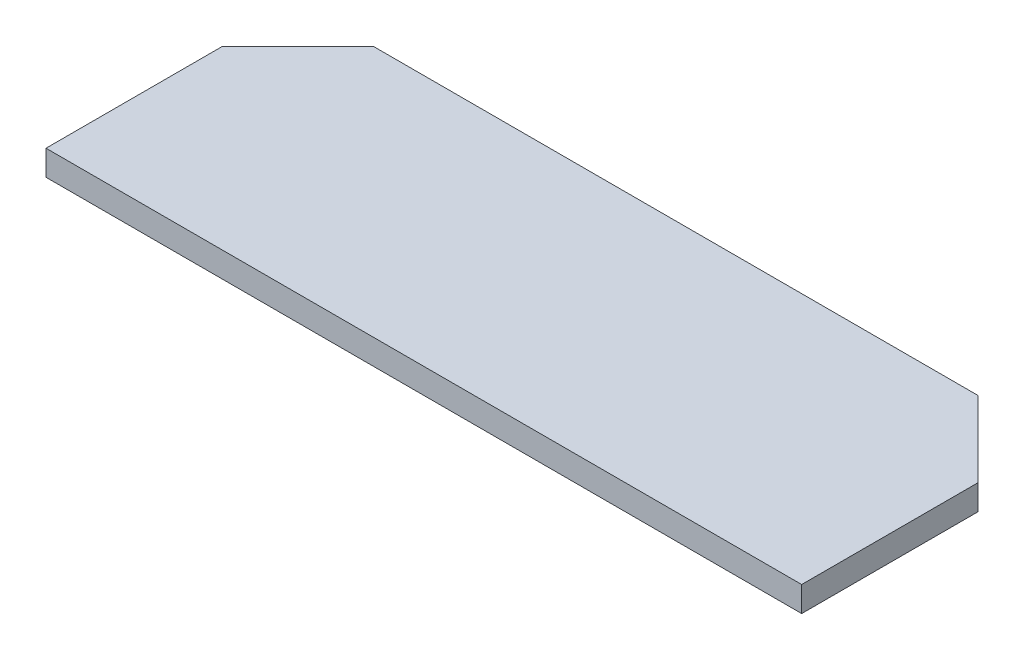
from build123d import *

# Parameters (mm, degrees)
BASE_EXTRUDE_DEPTH = 6.35


with BuildPart() as part:
    # Sketch1 → Base-Extrude (new body)
    with BuildSketch(Plane(origin=(0, 0, 0), x_dir=(1, 0, 0), z_dir=(0, 1, 0))):
        Polygon((-76.2, 0), (76.2, 0), (95.25, -19.05), (95.25, -63.5), (-95.25, -63.5), (-95.25, -19.05), align=None)
    extrude(amount=-BASE_EXTRUDE_DEPTH)


solid = part.part
